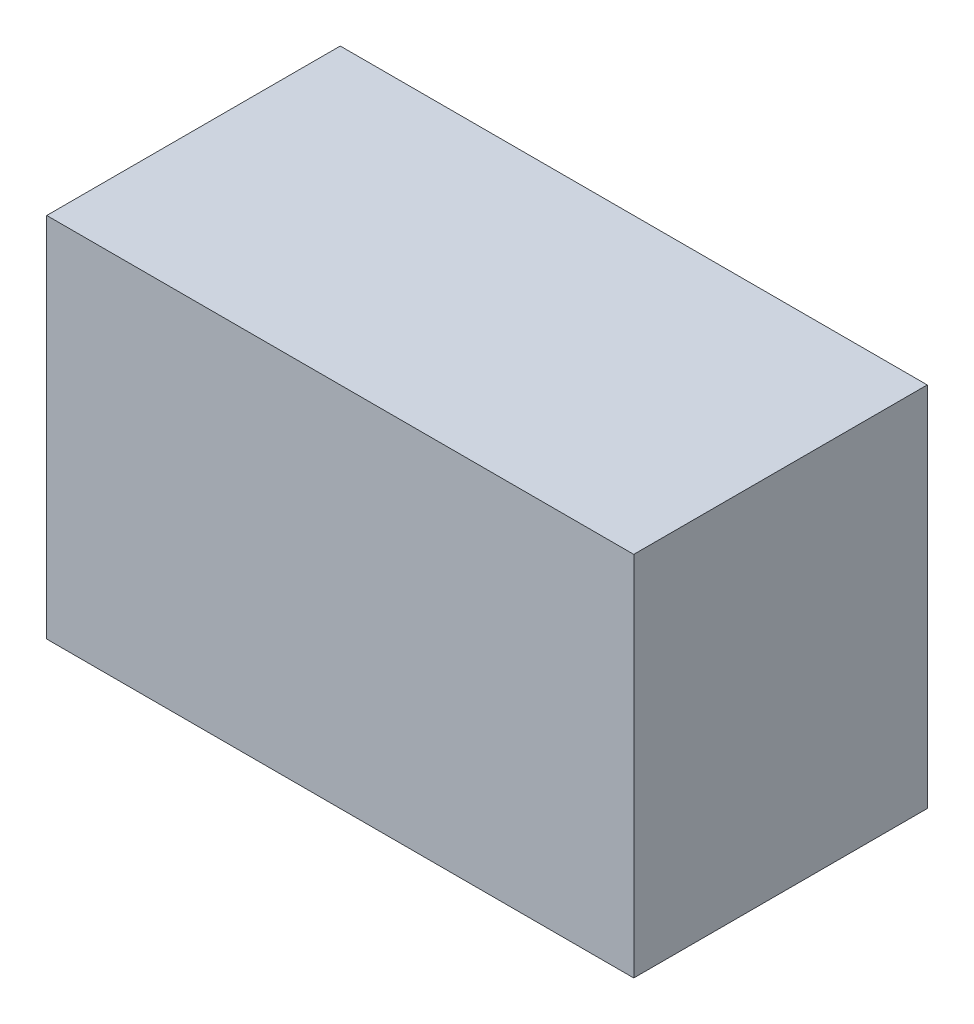
from build123d import *

# Parameters (mm, degrees)
SKETCH1_W      = 2032
SKETCH1_H      = 1016
EXTRUDE1_DEPTH = 1270


with BuildPart() as part:
    # Sketch1 → Extrude1 (new body)
    with BuildSketch(Plane(origin=(0, 0, 0), x_dir=(1, 0, 0), z_dir=(0, 1, 0))):
        with Locations((1016, 508)):
            Rectangle(SKETCH1_W, SKETCH1_H)
    extrude(amount=EXTRUDE1_DEPTH)


solid = part.part
